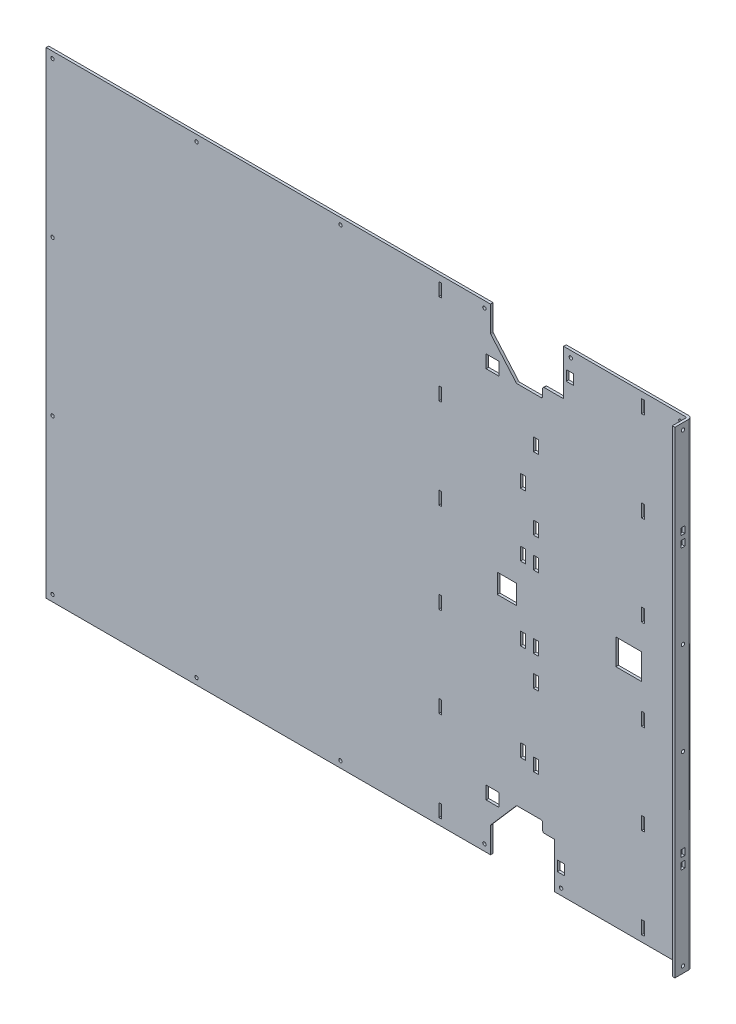
from build123d import *

# Parameters (mm, degrees)
SKETCH_1_W               = 994
SKETCH_1_H               = 740
EXTRUDE_1_DEPTH          = 4
CUT_EXTRUDE_3_DEPTH      = 1240.214267187
SKETCH_10_W              = 20
SKETCH_10_H              = 20
SKETCH_10_W_2            = 40
SKETCH_10_H_2            = 40
SKETCH_10_W_3            = 30
SKETCH_10_H_3            = 30
CUT_EXTRUDE_4_DEPTH      = 1240.214267187
SKETCH_11_W              = 11
SKETCH_11_H              = 15.8
CUT_EXTRUDE_5_DEPTH      = 1240.214267187
SKETCH_2_R               = 2.6
CUT_EXTRUDE_1_DEPTH      = 1240.214267187
SKETCH_12_W              = 8
SKETCH_12_H              = 20
CUT_EXTRUDE_6_DEPTH      = 1240.214267187
CUT_EXTRUDE_7_DEPTH      = 1240.214267187
CUT_EXTRUDE_7_DEPTH_BACK = 1240.214267187
SKETCH_13_W              = 4.2
SKETCH_13_H              = 20.2
SKETCH_6_W               = 26.45
SKETCH_6_H               = 740
EXTRUDE_2_DEPTH          = 4
SKETCH_8_W               = 5.8
SKETCH_8_H               = 10.5
CUT_EXTRUDE_2_DEPTH      = 1243.700125734
SKETCH_14_R              = 2.6
CUT_EXTRUDE_8_DEPTH      = 1243.700125734
FILLET_1_R               = 1.5
FILLET_2_R               = 5.5
FILLET_4_R               = 2.5


with BuildPart() as part:
    # Эскиз1 → Бобышка-Вытянуть1 (new body)
    with BuildSketch(Plane.XY):
        with Locations((497, 370)):
            Rectangle(SKETCH_1_W, SKETCH_1_H)
    extrude(amount=EXTRUDE_1_DEPTH)

    # Эскиз9 → Вырез-Вытянуть3 (cut, through all)
    with BuildSketch(Plane(origin=(0, 0, 0), x_dir=(-1, 0, 0), z_dir=(0, 0, -1))):
        Polygon((-689.6, -0.4), (-788.9, -0.4), (-788.9, 70.5), (-770.4, 70.5), (-770.4, 86.4), (-729.817747803, 86.4), (-689.6, 40.149590026), align=None)
        Polygon((-689.6, 740.4), (-802.9, 740.4), (-802.9, 669.5), (-770.4, 669.5), (-770.4, 653.6), (-729.817747803, 653.6), (-689.6, 699.850409974), align=None)
    extrude(amount=-CUT_EXTRUDE_3_DEPTH, mode=Mode.SUBTRACT)

    # Эскиз10 → Вырез-Вытянуть4 (cut, through all)
    with BuildSketch(Plane(origin=(0, 0, 0), x_dir=(-1, 0, 0), z_dir=(0, 0, -1))):
        with Locations((-692.63780609, 80.345862825)):
            Rectangle(SKETCH_10_W, SKETCH_10_H)
        with Locations((-904, 370)):
            Rectangle(SKETCH_10_W_2, SKETCH_10_H_2)
        with Locations((-692.63780609, 659.654137175)):
            Rectangle(SKETCH_10_W, SKETCH_10_H)
        with Locations((-715, 370)):
            Rectangle(SKETCH_10_W_3, SKETCH_10_H_3)
    extrude(amount=-CUT_EXTRUDE_4_DEPTH, mode=Mode.SUBTRACT)

    # Эскиз11 → Вырез-Вытянуть5 (cut, through all)
    with BuildSketch(Plane(origin=(0, 0, 0), x_dir=(-1, 0, 0), z_dir=(0, 0, -1))):
        with Locations((-798.5, 37.1)):
            Rectangle(SKETCH_11_W, SKETCH_11_H)
        with Locations((-812.5, 702.9)):
            Rectangle(SKETCH_11_W, SKETCH_11_H)
    extrude(amount=-CUT_EXTRUDE_5_DEPTH, mode=Mode.SUBTRACT)

    # Эскиз2 → Вырез-Вытянуть1 (cut, through all)
    with BuildSketch(Plane(origin=(0, 0, 0), x_dir=(-1, 0, 0), z_dir=(0, 0, -1))):
        with Locations((-10, 10)):
            Circle(SKETCH_2_R)
        with Locations((-10, 250)):
            Circle(SKETCH_2_R)
        with Locations((-10, 490)):
            Circle(SKETCH_2_R)
        with Locations((-10, 730)):
            Circle(SKETCH_2_R)
        with Locations((-984, 10)):
            Circle(SKETCH_2_R)
        with Locations((-984, 250)):
            Circle(SKETCH_2_R)
        with Locations((-984, 490)):
            Circle(SKETCH_2_R)
        with Locations((-984, 730)):
            Circle(SKETCH_2_R)
        with Locations((-233.33, 10)):
            Circle(SKETCH_2_R)
        with Locations((-233.33, 730)):
            Circle(SKETCH_2_R)
        with Locations((-456.66, 10)):
            Circle(SKETCH_2_R)
        with Locations((-456.66, 730)):
            Circle(SKETCH_2_R)
        with Locations((-679.99, 10)):
            Circle(SKETCH_2_R)
        with Locations((-679.99, 730)):
            Circle(SKETCH_2_R)
        with Locations((-799, 10)):
            Circle(SKETCH_2_R)
        with Locations((-814, 730)):
            Circle(SKETCH_2_R)
    extrude(amount=-CUT_EXTRUDE_1_DEPTH, mode=Mode.SUBTRACT)

    # Эскиз12 → Вырез-Вытянуть6 (cut, through all)
    with BuildSketch(Plane(origin=(0, 0, 0), x_dir=(-1, 0, 0), z_dir=(0, 0, -1))):
        with Locations((-760, 314)):
            Rectangle(SKETCH_12_W, SKETCH_12_H)
        with Locations((-740, 314)):
            Rectangle(SKETCH_12_W, SKETCH_12_H)
        with Locations((-760, 267)):
            Rectangle(SKETCH_12_W, SKETCH_12_H)
        with Locations((-760, 155)):
            Rectangle(SKETCH_12_W, SKETCH_12_H)
        with Locations((-760, 426)):
            Rectangle(SKETCH_12_W, SKETCH_12_H)
        with Locations((-760, 473)):
            Rectangle(SKETCH_12_W, SKETCH_12_H)
        with Locations((-760, 585)):
            Rectangle(SKETCH_12_W, SKETCH_12_H)
        with Locations((-740, 164)):
            Rectangle(SKETCH_12_W, SKETCH_12_H)
        with Locations((-740, 428)):
            Rectangle(SKETCH_12_W, SKETCH_12_H)
        with Locations((-740, 525.85)):
            Rectangle(SKETCH_12_W, SKETCH_12_H)
    extrude(amount=-CUT_EXTRUDE_6_DEPTH, mode=Mode.SUBTRACT)

    # Эскиз13 → Вырез-Вытянуть7 (cut, two sides: drawn at the far end of the back side and taken through both)
    with BuildSketch(Plane(origin=(0, 0, 0), x_dir=(-1, 0, 0), z_dir=(0, 0, -1)).offset(-CUT_EXTRUDE_7_DEPTH_BACK)):
        with Locations((-611.5, 20)):
            Rectangle(SKETCH_13_W, SKETCH_13_H)
        with Locations((-926, 20)):
            Rectangle(SKETCH_13_W, SKETCH_13_H)
        with Locations((-611.5, 160)):
            Rectangle(SKETCH_13_W, SKETCH_13_H)
        with Locations((-611.5, 300)):
            Rectangle(SKETCH_13_W, SKETCH_13_H)
        with Locations((-611.5, 440)):
            Rectangle(SKETCH_13_W, SKETCH_13_H)
        with Locations((-611.5, 580)):
            Rectangle(SKETCH_13_W, SKETCH_13_H)
        with Locations((-611.5, 720)):
            Rectangle(SKETCH_13_W, SKETCH_13_H)
        with Locations((-926, 160)):
            Rectangle(SKETCH_13_W, SKETCH_13_H)
        with Locations((-926, 300)):
            Rectangle(SKETCH_13_W, SKETCH_13_H)
        with Locations((-926, 440)):
            Rectangle(SKETCH_13_W, SKETCH_13_H)
        with Locations((-926, 580)):
            Rectangle(SKETCH_13_W, SKETCH_13_H)
        with Locations((-926, 720)):
            Rectangle(SKETCH_13_W, SKETCH_13_H)
    extrude(amount=CUT_EXTRUDE_7_DEPTH + CUT_EXTRUDE_7_DEPTH_BACK, mode=Mode.SUBTRACT)

    # Эскиз6 → Бобышка-Вытянуть2 (add)
    with BuildSketch(Plane(origin=(994, 0, 0), x_dir=(0, 0, -1), z_dir=(1, 0, 0))):
        with Locations((-13.225, 370)):
            Rectangle(SKETCH_6_W, SKETCH_6_H)
    extrude(amount=EXTRUDE_2_DEPTH)

    # Эскиз8 → Вырез-Вытянуть2 (cut, through all)
    with BuildSketch(Plane(origin=(998, 0, 0), x_dir=(0, 0, -1), z_dir=(1, 0, 0))):
        with Locations((-13.98, 145.25)):
            Rectangle(SKETCH_8_W, SKETCH_8_H)
        with Locations((-13.98, 162.25)):
            Rectangle(SKETCH_8_W, SKETCH_8_H)
        with Locations((-13.98, 577.75)):
            Rectangle(SKETCH_8_W, SKETCH_8_H)
        with Locations((-13.98, 594.75)):
            Rectangle(SKETCH_8_W, SKETCH_8_H)
    extrude(amount=-CUT_EXTRUDE_2_DEPTH, mode=Mode.SUBTRACT)

    # Эскиз14 → Вырез-Вытянуть8 (cut, through all)
    with BuildSketch(Plane(origin=(998, 0, 0), x_dir=(0, 0, -1), z_dir=(1, 0, 0))):
        with Locations((-14, 10)):
            Circle(SKETCH_14_R)
        with Locations((-14, 298)):
            Circle(SKETCH_14_R)
        with Locations((-14, 442)):
            Circle(SKETCH_14_R)
        with Locations((-14, 730)):
            Circle(SKETCH_14_R)
    extrude(amount=-CUT_EXTRUDE_8_DEPTH, mode=Mode.SUBTRACT)

    # Скругление1
    fillet_1_edges = [part.edges().sort_by_distance(p)[0] for p in [
        (994, 370, 4),
    ]]
    fillet(fillet_1_edges, radius=FILLET_1_R)

    # Скругление2
    fillet_2_edges = [part.edges().sort_by_distance(p)[0] for p in [
        (998, 370, 0),
    ]]
    fillet(fillet_2_edges, radius=FILLET_2_R)

    # Скругление4
    fillet_4_edges = [part.edges().sort_by_distance(p)[0] for p in [
        (689.6, 40.149590026, 2),
        (770.4, 70.5, 2),
        (770.4, 86.4, 2),
        (729.817747803, 86.4, 2),
        (689.6, 699.850409974, 2),
        (729.817747803, 653.6, 2),
        (770.4, 653.6, 2),
        (770.4, 669.5, 2),
    ]]
    fillet(fillet_4_edges, radius=FILLET_4_R)


solid = part.part
